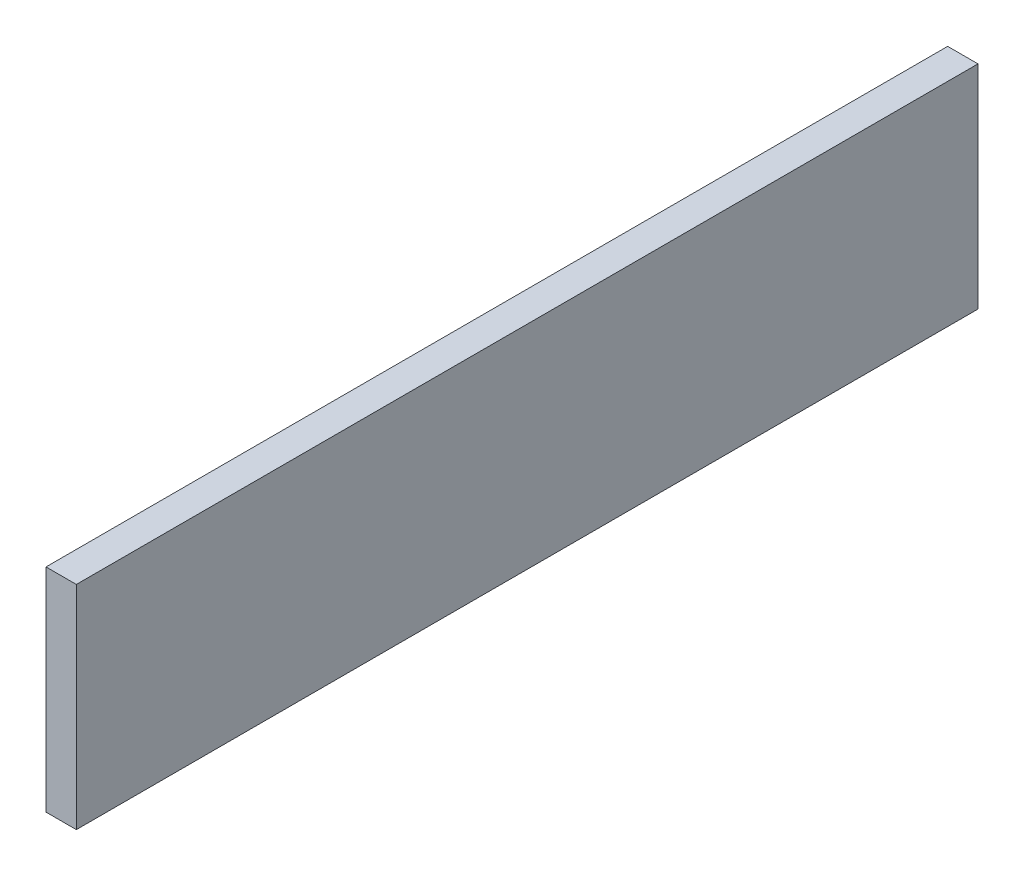
from build123d import *

# Parameters (mm, degrees)
BOSS_EXTRUDE1_DEPTH      = 59.44
BOSS_EXTRUDE1_DEPTH_BACK = 59.44
SKETCH1_W                = 4
SKETCH1_H                = 28


with BuildPart() as part:
    # Sketch1 → Boss-Extrude1 (new, two sides: drawn at the far end of the back side and taken through both)
    with BuildSketch(Plane.XY.offset(-BOSS_EXTRUDE1_DEPTH_BACK)):
        Rectangle(SKETCH1_W, SKETCH1_H)
    extrude(amount=BOSS_EXTRUDE1_DEPTH + BOSS_EXTRUDE1_DEPTH_BACK)


solid = part.part
